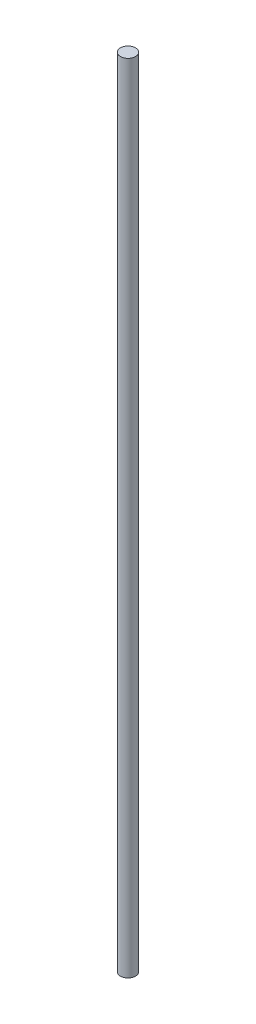
from build123d import *

# Parameters (mm, degrees)
SKETCH1_R           = 4.75
BOSS_EXTRUDE1_DEPTH = 500


with BuildPart() as part:
    # Sketch1 → Boss-Extrude1 (new body)
    with BuildSketch(Plane(origin=(0, 0, 0), x_dir=(1, 0, 0), z_dir=(0, 1, 0))):
        with Locations(Location((0, 0, 0), (0, 0, 270))):
            Circle(SKETCH1_R)
    extrude(amount=BOSS_EXTRUDE1_DEPTH)


solid = part.part
